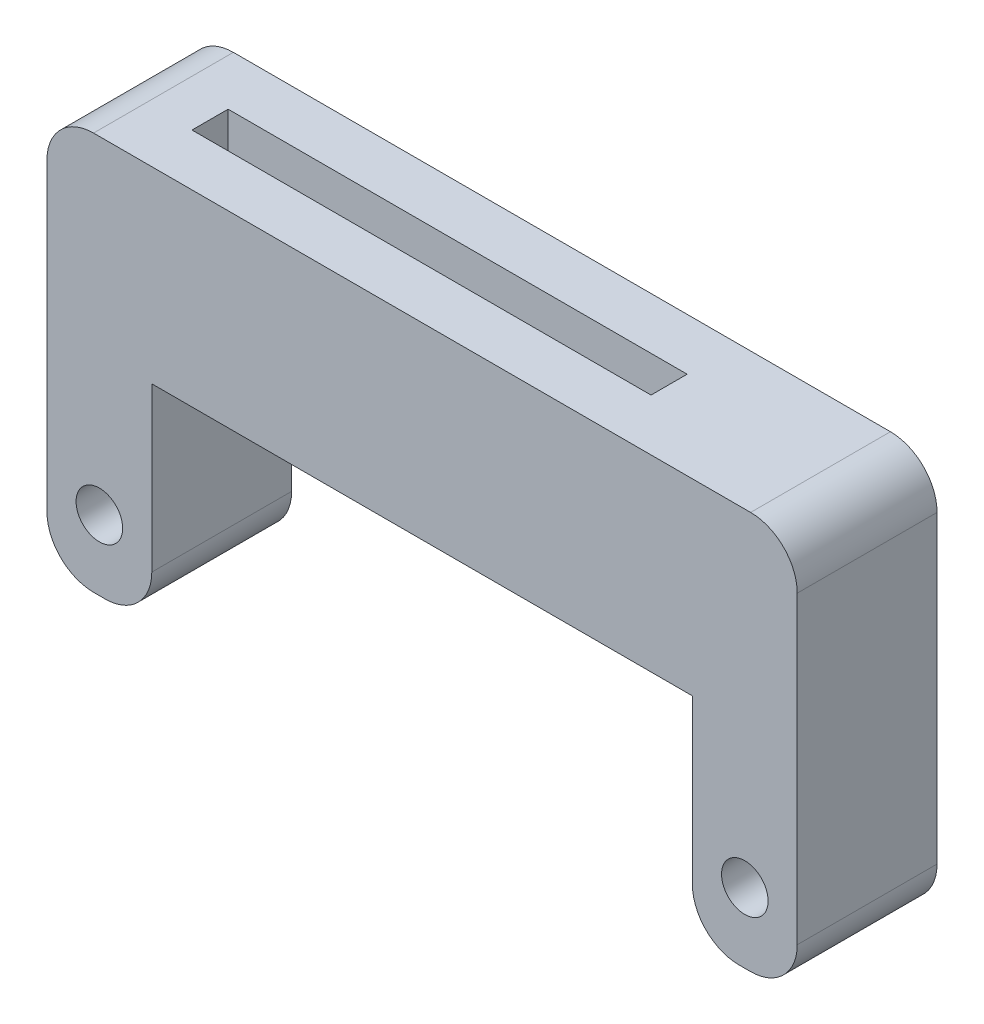
from build123d import *

# Parameters (mm, degrees)
SKETCH2_W           = 32.2
SKETCH2_H           = 17.068
BOSS_EXTRUDE1_DEPTH = 3
SKETCH3_W           = 19.7
SKETCH3_H           = 1.55
CUT_EXTRUDE1_DEPTH  = 5
SKETCH4_W           = 23.2
SKETCH4_H           = 9
CUT_EXTRUDE2_DEPTH  = 20.18434664
SKETCH5_R           = 1
CUT_EXTRUDE3_DEPTH  = 20.18434664
FILLET1_R           = 2


with BuildPart() as part:
    # Sketch2 → Boss-Extrude1 (new, symmetric)
    with BuildSketch(Plane.XY):
        Rectangle(SKETCH2_W, SKETCH2_H)
    extrude(amount=BOSS_EXTRUDE1_DEPTH, both=True)

    # Sketch3 → Cut-Extrude1 (cut)
    with BuildSketch(Plane(origin=(0, 8.534, 0), x_dir=(1, 0, 0), z_dir=(0, 1, 0))):
        with Locations((-2.25, 0)):
            Rectangle(SKETCH3_W, SKETCH3_H)
    extrude(amount=-CUT_EXTRUDE1_DEPTH, mode=Mode.SUBTRACT)

    # Sketch4 → Cut-Extrude2 (cut, through all)
    with BuildSketch(Plane.XY.offset(3)):
        with Locations((0, -4.034)):
            Rectangle(SKETCH4_W, SKETCH4_H)
    extrude(amount=-CUT_EXTRUDE2_DEPTH, mode=Mode.SUBTRACT)

    # Sketch5 → Cut-Extrude3 (cut, through all)
    with BuildSketch(Plane.XY.offset(3)):
        with Locations((-13.85, -5.534)):
            Circle(SKETCH5_R)
        with Locations((13.85, -5.534)):
            Circle(SKETCH5_R)
    extrude(amount=-CUT_EXTRUDE3_DEPTH, mode=Mode.SUBTRACT)

    # Fillet1
    fillet1_edges = [part.edges().sort_by_distance(p)[0] for p in [
        (-11.6, -8.534, 0),
        (11.6, -8.534, 0),
        (16.1, -8.534, 0),
        (-16.1, -8.534, 0),
        (-16.1, 8.534, 0),
        (16.1, 8.534, 0),
    ]]
    fillet(fillet1_edges, radius=FILLET1_R)


solid = part.part
